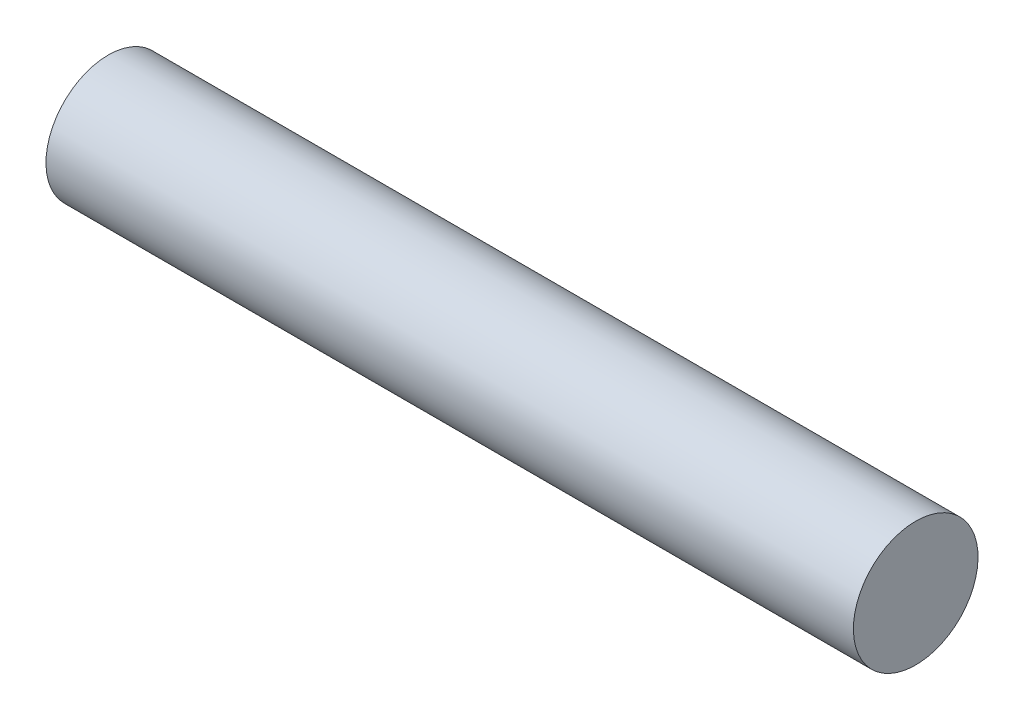
from build123d import *

# Parameters (mm, degrees)
ESQUISSE1_W = 46
ESQUISSE1_H = 3.55


with BuildPart() as part:
    # Esquisse1 → Révolution1 (revolve)
    with BuildSketch(Plane.XY):
        with Locations((23, 1.775)):
            Rectangle(ESQUISSE1_W, ESQUISSE1_H)
    revolve(axis=Axis((46, 0, 0), (-1, 0, 0)))


solid = part.part
